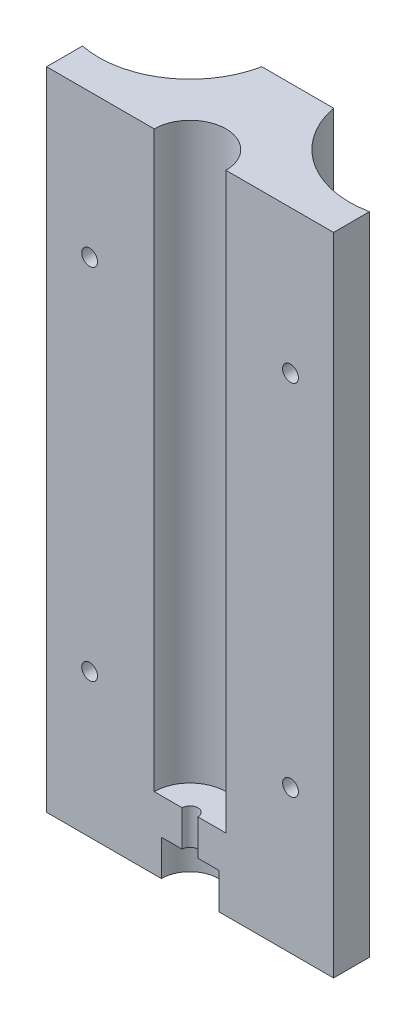
from build123d import *

# Parameters (mm, degrees)
SKIZZE2_W                                    = 40
SKIZZE2_H                                    = 15
AUFSATZ_LINEAR_AUSTRAGEN1_DEPTH              = 90
SKIZZE3_R                                    = 5
SCHNITT_LINEAR_AUSTRAGEN1_DEPTH              = 80
SKIZZE4_R                                    = 4
SCHNITT_LINEAR_AUSTRAGEN2_DEPTH              = 5
SKIZZE5_R                                    = 1.1
SCHNITT_LINEAR_AUSTRAGEN3_DEPTH              = 91.691785736
STIRNSENKUNG_F_R_M2_FLACHKOPFSCHRAUB_2_COUNT = 2
STIRNSENKUNG_F_R_M2_FLACHKOPFSCHRAUB_2_PITCH = 50
STIRNSENKUNG_F_R_M2_FLACHKOPFSCHRAUB_3_COUNT = 2
STIRNSENKUNG_F_R_M2_FLACHKOPFSCHRAUB_3_PITCH = 57.306195128
STIRNSENKUNG_F_R_M2_FLACHKOPFSCHRAUB_4_COUNT = 2
STIRNSENKUNG_F_R_M2_FLACHKOPFSCHRAUB_4_PITCH = 28
SCHNITT_LINEAR_AUSTRAGEN6_DEPTH              = 100.624294226
SCHNITT_LINEAR_AUSTRAGEN6_DEPTH_BACK         = 100.624294226
SCHNITT_LINEAR_AUSTRAGEN7_DEPTH              = 100.624294371
SCHNITT_LINEAR_AUSTRAGEN7_DEPTH_BACK         = 100.624294371


with BuildPart() as part:
    # Skizze2 → Aufsatz-Linear austragen1 (new body)
    with BuildSketch(Plane(origin=(0, 0, 0), x_dir=(1, 0, 0), z_dir=(0, 1, 0))):
        with Locations((20, 7.5)):
            Rectangle(SKIZZE2_W, SKIZZE2_H)
    extrude(amount=AUFSATZ_LINEAR_AUSTRAGEN1_DEPTH)

    # Skizze3 → Schnitt-Linear austragen1 (cut)
    with BuildSketch(Plane(origin=(0, 90, 0), x_dir=(1, 0, 0), z_dir=(0, 1, 0))):
        with Locations((20, 0)):
            Circle(SKIZZE3_R)
    extrude(amount=-SCHNITT_LINEAR_AUSTRAGEN1_DEPTH, mode=Mode.SUBTRACT)

    # Skizze4 → Schnitt-Linear austragen2 (cut)
    with BuildSketch(Plane.XZ):
        with Locations((20, 0)):
            Circle(SKIZZE4_R)
    extrude(amount=-SCHNITT_LINEAR_AUSTRAGEN2_DEPTH, mode=Mode.SUBTRACT)

    # Skizze5 → Schnitt-Linear austragen3 (cut, through all)
    with BuildSketch(Plane(origin=(0, 10, 0), x_dir=(1, 0, 0), z_dir=(0, 1, 0))):
        with Locations((20, 0)):
            Circle(SKIZZE5_R)
    extrude(amount=-SCHNITT_LINEAR_AUSTRAGEN3_DEPTH, mode=Mode.SUBTRACT)

    # Skizze8 → Stirnsenkung für M2 Flachkopfschraube mit Schlitz1 (revolve, cut)
    with BuildSketch(Plane(origin=(6, 70, -15), x_dir=(0, 1, 0), z_dir=(1, 0, 0))):
        Polygon((0, 0), (0, 15), (1.1, 15), (1.1, 12.6), (2.5, 12.6), (2.5, 1), (3.5, 0), align=None)
    stirnsenkung_f_r_m2_flachkopfschraube_mi = revolve(axis=Axis((6, 70, -21.35), (0, 0, 1)), mode=Mode.SUBTRACT)

    # Stirnsenkung f_r M2 Flachkopfschraub 2: Stirnsenkung für M2 Flachkopfschraube mit Schlitz1 ×2
    with Locations(*[(0, -i * STIRNSENKUNG_F_R_M2_FLACHKOPFSCHRAUB_2_PITCH, 0) for i in range(1, STIRNSENKUNG_F_R_M2_FLACHKOPFSCHRAUB_2_COUNT)]):
        add(stirnsenkung_f_r_m2_flachkopfschraube_mi, mode=Mode.SUBTRACT)

    # Stirnsenkung f_r M2 Flachkopfschraub 3: Stirnsenkung für M2 Flachkopfschraube mit Schlitz1 ×2
    with Locations(*[Vector(0.48860336893184336, -0.87250601594972, 0) * (i * STIRNSENKUNG_F_R_M2_FLACHKOPFSCHRAUB_3_PITCH) for i in range(1, STIRNSENKUNG_F_R_M2_FLACHKOPFSCHRAUB_3_COUNT)]):
        add(stirnsenkung_f_r_m2_flachkopfschraube_mi, mode=Mode.SUBTRACT)

    # Stirnsenkung f_r M2 Flachkopfschraub 4: Stirnsenkung für M2 Flachkopfschraube mit Schlitz1 ×2
    with Locations(*[(i * STIRNSENKUNG_F_R_M2_FLACHKOPFSCHRAUB_4_PITCH, 0, 0) for i in range(1, STIRNSENKUNG_F_R_M2_FLACHKOPFSCHRAUB_4_COUNT)]):
        add(stirnsenkung_f_r_m2_flachkopfschraube_mi, mode=Mode.SUBTRACT)

    # Skizze11 → Schnitt-Linear austragen6 (cut, two sides: drawn at the far end of the back side and taken through both)
    with BuildSketch(Plane(origin=(0, 90, 0), x_dir=(1, 0, 0), z_dir=(0, 1, 0)).offset(-SCHNITT_LINEAR_AUSTRAGEN6_DEPTH_BACK)):
        with BuildLine():
            Line((130.666560763, 23.133312153), (40, 5))
            ThreePointArc((40, 5), (30.428932188, 6.893398282), (25, 15))
            Line((25, 15), (6.866687847, 105.666560763))
            Line((6.866687847, 105.666560763), (109.444191755, 259.532816625))
            Line((109.444191755, 259.532816625), (233.244064671, 176.999568015))
            Line((233.244064671, 176.999568015), (130.666560763, 23.133312153))
        make_face()
    extrude(amount=SCHNITT_LINEAR_AUSTRAGEN6_DEPTH + SCHNITT_LINEAR_AUSTRAGEN6_DEPTH_BACK, mode=Mode.SUBTRACT)

    # Skizze14 → Schnitt-Linear austragen7 (cut, two sides: drawn at the far end of the back side and taken through both)
    with BuildSketch(Plane(origin=(0, 90, 0), x_dir=(1, 0, 0), z_dir=(0, 1, 0)).offset(-SCHNITT_LINEAR_AUSTRAGEN7_DEPTH_BACK)):
        with BuildLine():
            Line((33.1333122, 105.666561001), (15, 15))
            ThreePointArc((15, 15), (9.571067812, 6.893398282), (0, 5))
            Line((0, 5), (-90.666561001, 23.1333122))
            Line((-90.666561001, 23.1333122), (-193.244065178, 176.999568466))
            Line((-193.244065178, 176.999568466), (-69.444191977, 259.532817267))
            Line((-69.444191977, 259.532817267), (33.1333122, 105.666561001))
        make_face()
    extrude(amount=SCHNITT_LINEAR_AUSTRAGEN7_DEPTH + SCHNITT_LINEAR_AUSTRAGEN7_DEPTH_BACK, mode=Mode.SUBTRACT)


solid = part.part
